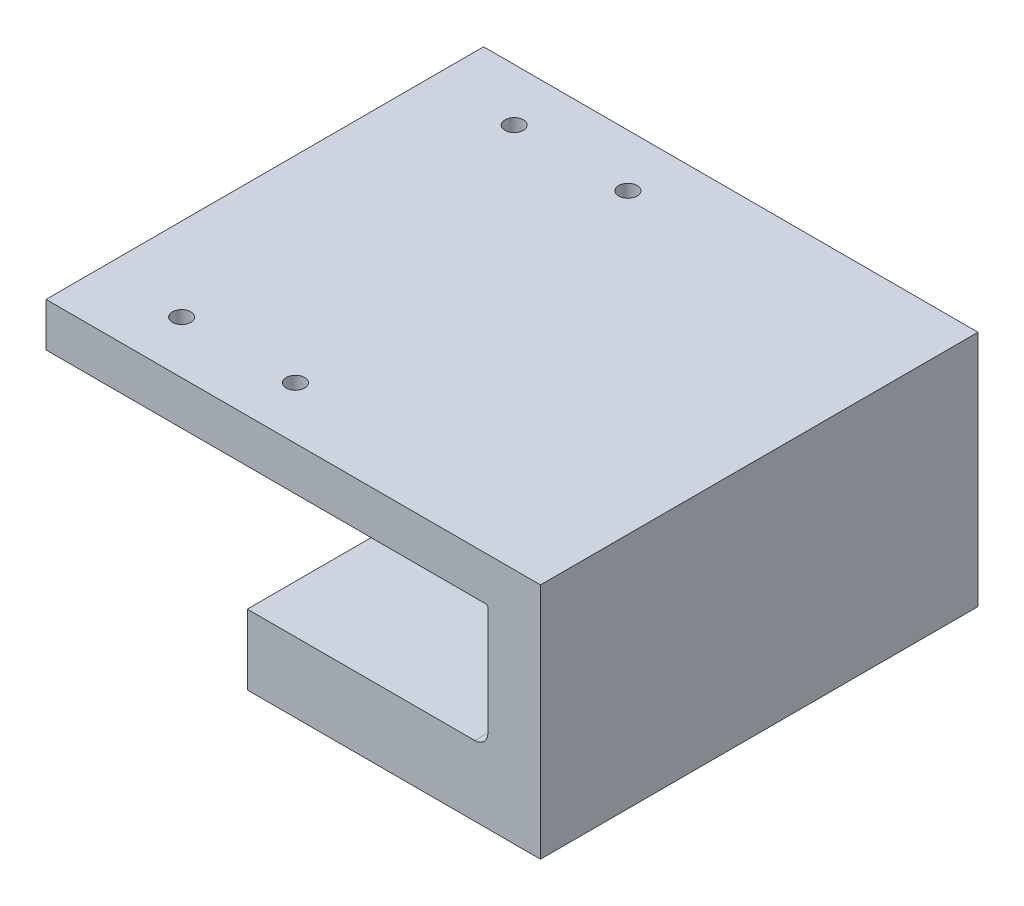
from build123d import *

# Parameters (mm, degrees)
BOSS_EXTRUDE1_DEPTH = 100
SKETCH4_R           = 4.3
CUT_EXTRUDE1_DEPTH  = 16
SKETCH5_W           = 13.3
SKETCH5_H           = 8.3
CUT_EXTRUDE2_DEPTH  = 27
SKETCH3_R           = 2.1
CUT_EXTRUDE3_DEPTH  = 8
CUT_EXTRUDE4_DEPTH  = 16
FILLET1_R           = 3
FILLET2_R           = 0.5


with BuildPart() as part:
    # Sketch1 → Boss-Extrude1 (new body)
    with BuildSketch(Plane.XY):
        Polygon((0, 0), (0, 10), (113, 10), (113, -44.3), (46, -44.3), (46, -28.3), (101, -28.3), (101, 0), align=None)
    extrude(amount=BOSS_EXTRUDE1_DEPTH)

    # Sketch4 → Cut-Extrude1 (cut)
    with BuildSketch(Plane.XZ.offset(44.3)):
        with Locations((66, 50)):
            Circle(SKETCH4_R)
    extrude(amount=-CUT_EXTRUDE1_DEPTH, mode=Mode.SUBTRACT)

    # Sketch5 → Cut-Extrude2 (cut)
    with BuildSketch(Plane.ZY.offset(-46)):
        with Locations((50, -36.3)):
            Rectangle(SKETCH5_W, SKETCH5_H)
    extrude(amount=-CUT_EXTRUDE2_DEPTH, mode=Mode.SUBTRACT)

    # Sketch3 → Cut-Extrude3 (cut)
    with BuildSketch(Plane(origin=(0, 10, 0), x_dir=(1, 0, 0), z_dir=(0, 1, 0))):
        with Locations(Location((19, -12, 0), (0, 0, 270))):
            Circle(SKETCH3_R)
        with Locations(Location((19, -88, 0), (0, 0, 270))):
            Circle(SKETCH3_R)
        with Locations(Location((45, -12, 0), (0, 0, 270))):
            Circle(SKETCH3_R)
        with Locations(Location((45, -88, 0), (0, 0, 270))):
            Circle(SKETCH3_R)
    extrude(amount=-CUT_EXTRUDE3_DEPTH, mode=Mode.SUBTRACT)

    # Sketch6 → Cut-Extrude4 (cut)
    with BuildSketch(Plane.XZ.offset(44.3)):
        Polygon((66, 56.08), (62.96, 53.04), (66, 50), (69.04, 53.04), align=None)
    extrude(amount=-CUT_EXTRUDE4_DEPTH, mode=Mode.SUBTRACT)

    # Fillet1
    fillet1_edges = [part.edges().sort_by_distance(p)[0] for p in [
        (101, -28.3, 50),
    ]]
    fillet(fillet1_edges, radius=FILLET1_R)

    # Fillet2
    fillet2_edges = [part.edges().sort_by_distance(p)[0] for p in [
        (101, 0, 50),
    ]]
    fillet(fillet2_edges, radius=FILLET2_R)


solid = part.part
